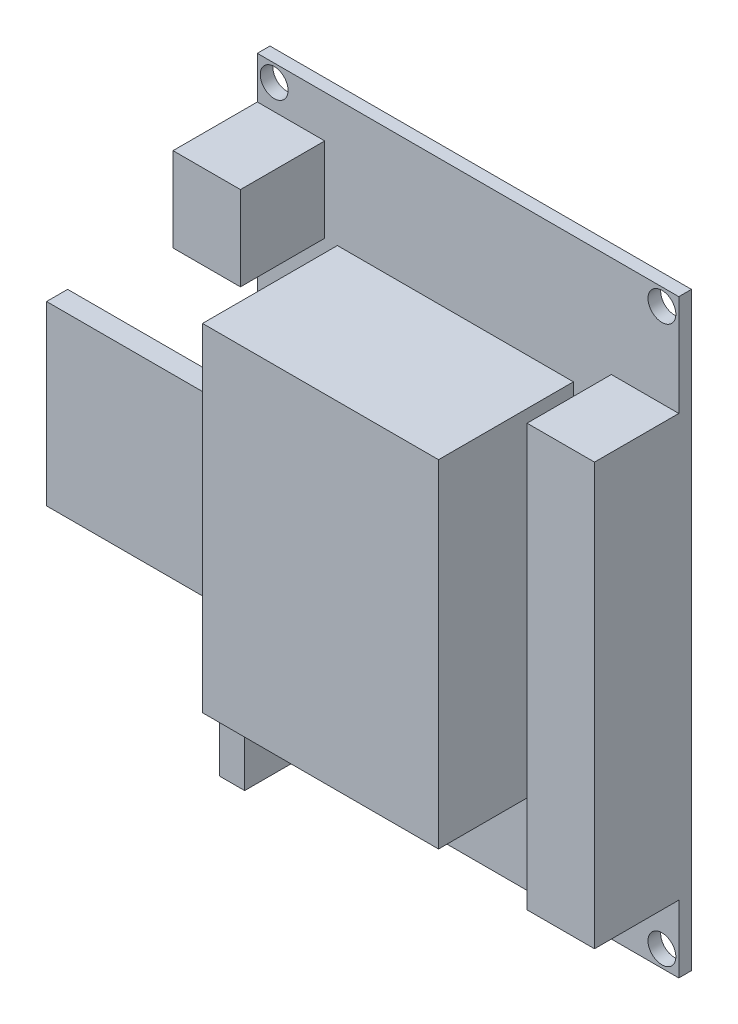
from build123d import *

# Parameters (mm, degrees)
SKETCH1_W               = 50
SKETCH1_H               = 70
SKETCH1_R               = 1.65
MAIN_PROTOBOARD_DEPTH   = 1.5
SCREW_TERMINALS_START   = 1.5
SKETCH1_3_W             = 8
SKETCH1_3_H             = 50
SKETCH1_3_H_2           = 10
SCREW_TERMINALS_DEPTH   = 10
MCU_START               = 1.5
SKETCH1_5_W             = 28
SKETCH1_5_H             = 40
MCU_DEPTH               = 16
SKETCH1_6_W             = 3
SKETCH1_6_H             = 41
DUPONT_CONNECTORS_DEPTH = 10
CAN_TRANSCEIVER_START   = 10
SKETCH1_7_W             = 14
SKETCH1_7_H             = 21
SKETCH1_7_W_2           = 4
SKETCH1_7_W_3           = 3
CAN_TRANSCEIVER_DEPTH   = 2.5
SKETCH1_8_W             = 28
SKETCH1_8_H             = 40
WIRE_CLEARANCE_DEPTH    = 6


with BuildPart() as part:
    # Sketch1 → Main-Protoboard (new body)
    with BuildSketch(Plane.XY):
        with Locations((25, 35)):
            Rectangle(SKETCH1_W, SKETCH1_H)
        with Locations((2, 2)):
            Circle(SKETCH1_R, mode=Mode.SUBTRACT)
        with Locations((48, 2)):
            Circle(SKETCH1_R, mode=Mode.SUBTRACT)
        with Locations((2, 68)):
            Circle(SKETCH1_R, mode=Mode.SUBTRACT)
        with Locations((48, 68)):
            Circle(SKETCH1_R, mode=Mode.SUBTRACT)
    extrude(amount=MAIN_PROTOBOARD_DEPTH)

    # Sketch1<3> → Screw-Terminals (add)
    with BuildSketch(Plane.XY.offset(SCREW_TERMINALS_START)):
        with Locations((46, 33)):
            Rectangle(SKETCH1_3_W, SKETCH1_3_H)
        with Locations((4, 60)):
            Rectangle(SKETCH1_3_W, SKETCH1_3_H_2)
    extrude(amount=SCREW_TERMINALS_DEPTH)

    # Sketch1<5> → MCU (add)
    with BuildSketch(Plane.XY.offset(MCU_START)):
        with Locations((23.5, 35)):
            Rectangle(SKETCH1_5_W, SKETCH1_5_H)
    extrude(amount=MCU_DEPTH)

    # Sketch1<6> → Dupont-Connectors (add)
    with BuildSketch(Plane.XY):
        with Locations((5.5, 22.5)):
            Rectangle(SKETCH1_6_W, SKETCH1_6_H)
    extrude(amount=DUPONT_CONNECTORS_DEPTH)

    # Sketch1<7> → Can-Transceiver (add)
    with BuildSketch(Plane.XY.offset(CAN_TRANSCEIVER_START)):
        with Locations((-7, 32.5)):
            Rectangle(SKETCH1_7_W, SKETCH1_7_H)
        with Locations((2, 32.5)):
            Rectangle(SKETCH1_7_W_2, SKETCH1_7_H)
        with Locations((5.5, 32.5)):
            Rectangle(SKETCH1_7_W_3, SKETCH1_7_H)
    extrude(amount=CAN_TRANSCEIVER_DEPTH)

    # Sketch1<8> → Wire-Clearance (add)
    with BuildSketch(Plane.XY):
        with Locations((23.5, 35)):
            Rectangle(SKETCH1_8_W, SKETCH1_8_H)
    extrude(amount=-WIRE_CLEARANCE_DEPTH)


solid = part.part
